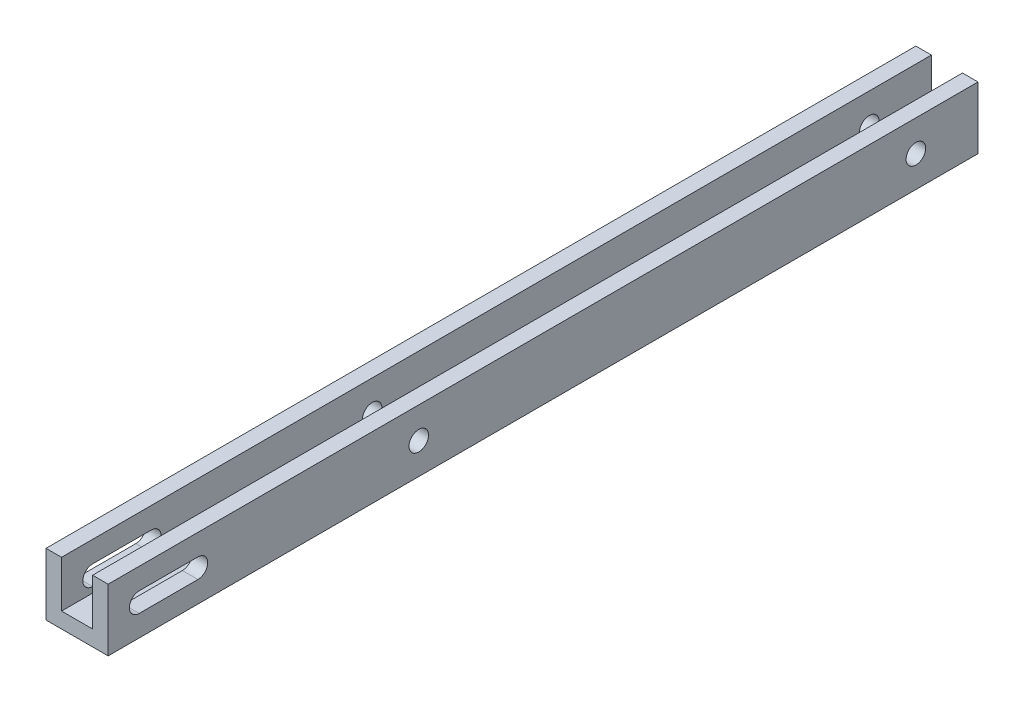
from build123d import *

# Parameters (mm, degrees)
BOSS_EXTRUDE1_DEPTH     = 88.9
CUT_EXTRUDE1_DEPTH      = 91.02678768
CUT_EXTRUDE1_DEPTH_BACK = 91.02678768
SKETCH3_R               = 2


with BuildPart() as part:
    # Sketch2 → Boss-Extrude1 (new, symmetric)
    with BuildSketch(Plane.XY):
        Polygon((-6.35, 6.35), (-6.35, -6.35), (6.35, -6.35), (6.35, 6.35), (3.175, 6.35), (3.175, -3.175), (-3.175, -3.175), (-3.175, 6.35), align=None)
    extrude(amount=BOSS_EXTRUDE1_DEPTH, both=True)

    # Sketch3 → Cut-Extrude1 (cut, two sides: drawn at the far end of the back side and taken through both)
    with BuildSketch(Plane(origin=(6.35, 0, 0), x_dir=(0, 0, -1), z_dir=(1, 0, 0)).offset(-CUT_EXTRUDE1_DEPTH_BACK)):
        with Locations(Location((-25.4, 0, 0), (0, 0, 90))):
            Circle(SKETCH3_R)
        with Locations(Location((76.2, 0, 0), (0, 0, 90))):
            Circle(SKETCH3_R)
        with BuildLine():
            Line((-82.55, 2), (-70.55, 2))
            ThreePointArc((-70.55, 2), (-68.55, 0), (-70.55, -2))
            Line((-70.55, -2), (-82.55, -2))
            ThreePointArc((-82.55, -2), (-84.55, 0), (-82.55, 2))
        make_face()
    extrude(amount=CUT_EXTRUDE1_DEPTH + CUT_EXTRUDE1_DEPTH_BACK, mode=Mode.SUBTRACT)


solid = part.part
